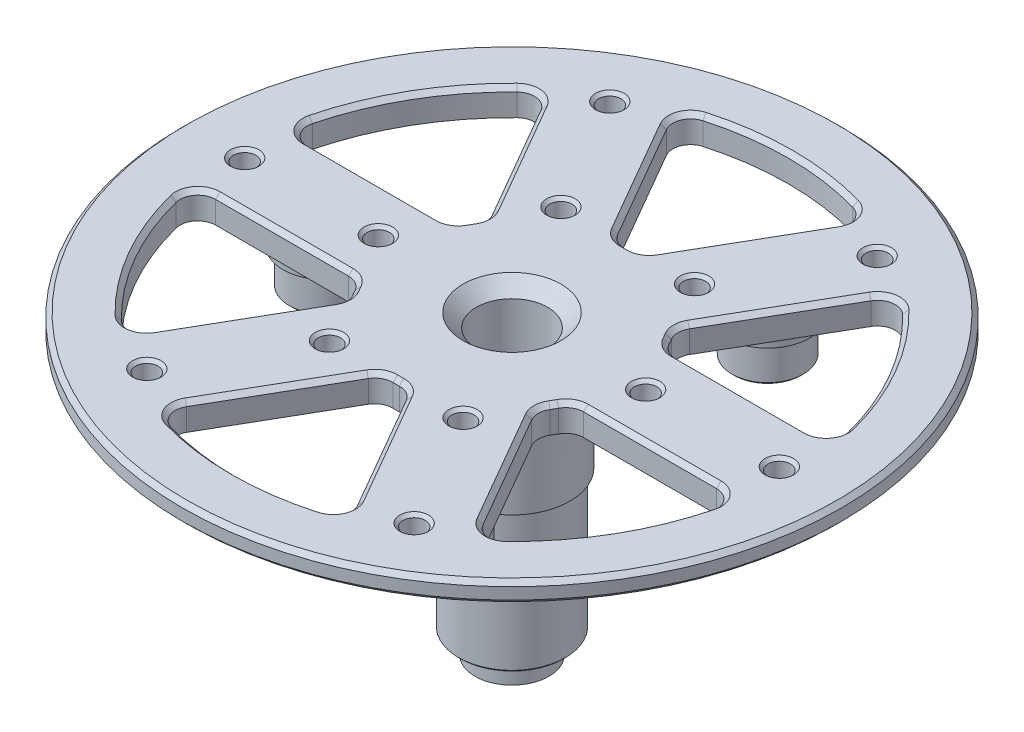
from build123d import *

# Parameters (mm, degrees)
CHAMFER1_SIZE                   = 0.5
CHAMFER2_SIZE                   = 0.25
CIRPATTERN1_COUNT               = 3
CHAMFER2_OF_CIRPATTERN1_SIZE    = 0.25
CHAMFER3_SIZE                   = 0.25
CHAMFER4_SIZE                   = 0.5
M3X0_5_TAPPED_HOLE1_D           = 2.5
M3X0_5_TAPPED_HOLE1_CSINK_D     = 3.2
M3X0_5_TAPPED_HOLE1_CSINK_ANGLE = 90
M3X0_5_TAPPED_HOLE2_D           = 2.5
M3X0_5_TAPPED_HOLE2_CSINK_D     = 3.2
M3X0_5_TAPPED_HOLE2_CSINK_ANGLE = 90
CIRPATTERN2_COUNT               = 6
CUT_EXTRUDE1_DEPTH              = 57.419943282
FILLET1_R                       = 2
CHAMFER5_SIZE                   = 0.5
CIRPATTERN3_COUNT               = 6
FILLET1_OF_CIRPATTERN3_R        = 2
CHAMFER5_OF_CIRPATTERN3_SIZE    = 0.5


with BuildPart() as part:
    # Sketch1 → Revolve1 (revolve)
    with BuildSketch(Plane.XY):
        Polygon((-3.15, -8.7), (-4, -8.7), (-4, 19.6), (-5.5, 21.1), (-37, 21.1), (-37, 18.8), (-32, 18.8), (-32, 18.1), (-6.5, 18.1), (-6.5, 6), (-6, 6), (-6, 5.15), (-6, -6), (-6, -7.1), (-6, -9.7), (-4.15, -9.7), (-4.15, -12.2), (-3.15, -12.2), align=None)
    revolve(axis=Axis((0, 0, 0), (0, -1, 0)))

    # Chamfer1
    chamfer1_edges = [part.edges().sort_by_distance(p)[0] for p in [
        (3.15, -12.2, 0),
    ]]
    chamfer(chamfer1_edges, length=CHAMFER1_SIZE)

    # Sketch2 → Planet bearing axis (revolve)
    with BuildSketch(Plane.XY):
        Polygon((-21, 18.1), (-25.7, 18.1), (-25.7, 17.1), (-25, 17.1), (-25, 13), (-21, 13), align=None)
    planet_bearing_axis = revolve(axis=Axis((-21, 33.164090746, 0), (0, -1, 0)))

    # Chamfer2
    chamfer2_edges = [part.edges().sort_by_distance(p)[0] for p in [
        (-17, 13, 0),
    ]]
    chamfer(chamfer2_edges, length=CHAMFER2_SIZE)

    # CirPattern1: Planet bearing axis ×3 about axis
    cirpattern1_axis = Axis((0, 0, 0), (0, 1, 0))
    for i in range(1, CIRPATTERN1_COUNT):
        add(planet_bearing_axis.rotate(cirpattern1_axis, i * 360 / CIRPATTERN1_COUNT))

    # Chamfer2 of CirPattern1
    chamfer2_of_cirpattern1_edges = [part.edges().sort_by_distance(p)[0] for p in [
        (8.5, 13, 14.722431864),
        (8.5, 13, -14.722431864),
    ]]
    chamfer(chamfer2_of_cirpattern1_edges, length=CHAMFER2_OF_CIRPATTERN1_SIZE)

    # Chamfer3
    chamfer3_edges = [part.edges().sort_by_distance(p)[0] for p in [
        (6, -9.7, 0),
    ]]
    chamfer(chamfer3_edges, length=CHAMFER3_SIZE)

    # Chamfer4
    chamfer4_edges = [part.edges().sort_by_distance(p)[0] for p in [
        (37, 21.1, 0),
        (37, 18.8, 0),
        (6.5, 18.1, 0),
    ]]
    chamfer(chamfer4_edges, length=CHAMFER4_SIZE)

    # M3x0.5 Tapped Hole1 (through all)
    with Locations(Plane(origin=(0, 21.1, 0), x_dir=(1, 0, 0), z_dir=(0, 1, 0))):
        with Locations((-30, 0)):
            m3x0_5_tapped_hole1 = CounterSinkHole(M3X0_5_TAPPED_HOLE1_D / 2, M3X0_5_TAPPED_HOLE1_CSINK_D / 2, counter_sink_angle=M3X0_5_TAPPED_HOLE1_CSINK_ANGLE)

    # M3x0.5 Tapped Hole2 (through all)
    with Locations(Plane(origin=(0, 21.1, 0), x_dir=(1, 0, 0), z_dir=(0, 1, 0))):
        with Locations((-15, 0)):
            m3x0_5_tapped_hole2 = CounterSinkHole(M3X0_5_TAPPED_HOLE2_D / 2, M3X0_5_TAPPED_HOLE2_CSINK_D / 2, counter_sink_angle=M3X0_5_TAPPED_HOLE2_CSINK_ANGLE)

    # CirPattern2: M3x0.5 Tapped Hole1, M3x0.5 Tapped Hole2 ×6 about axis
    cirpattern2_axis = Axis((0, 0, 0), (0, 1, 0))
    add([m3x0_5_tapped_hole1.rotate(cirpattern2_axis, i * 360 / CIRPATTERN2_COUNT) for i in range(1, CIRPATTERN2_COUNT)], mode=Mode.SUBTRACT)
    add([m3x0_5_tapped_hole2.rotate(cirpattern2_axis, i * 360 / CIRPATTERN2_COUNT) for i in range(1, CIRPATTERN2_COUNT)], mode=Mode.SUBTRACT)

    # Sketch7 → Cut-Extrude1 (cut, through all)
    with BuildSketch(Plane(origin=(0, 0, 0), x_dir=(1, 0, 0), z_dir=(0, 1, 0))):
        with BuildLine():
            Line((-19.745135369, -23.898318544), (-10.428637185, -7.76167034))
            ThreePointArc((-10.428637185, -7.76167034), (-11.258330249, -6.5), (-11.936122283, -5.150629559))
            Line((-11.936122283, -5.150629559), (-30.569118652, -5.150629559))
            ThreePointArc((-30.569118652, -5.150629559), (-26.846787517, -15.5), (-19.745135369, -23.898318544))
        make_face()
    cut_extrude1 = extrude(amount=CUT_EXTRUDE1_DEPTH, mode=Mode.SUBTRACT)

    # Fillet1
    fillet1_edges = [part.edges().sort_by_distance(p)[0] for p in [
        (-19.745135369, 19.6, 23.898318544),
        (-30.569118652, 19.6, 5.150629559),
        (-10.428637185, 19.6, 7.76167034),
        (-11.936122283, 19.6, 5.150629559),
    ]]
    fillet(fillet1_edges, radius=FILLET1_R)

    # Chamfer5
    chamfer5_edges = [part.edges().sort_by_distance(p)[0] for p in [
        (-14.783205948, 21.1, 15.304004683),
        (-10.785765167, 21.1, 7.817335996),
        (-19.971331194, 21.1, 22.745180132),
        (-11.258330249, 21.1, 6.5),
        (-26.846787517, 21.1, 15.5),
        (-12.162894146, 21.1, 5.432078636),
        (-29.683569404, 21.1, 5.923090095),
        (-20.645259809, 21.1, 5.150629559),
    ]]
    chamfer(chamfer5_edges, length=CHAMFER5_SIZE)

    # CirPattern3: Cut-Extrude1 ×6 about axis
    cirpattern3_axis = Axis((0, 0, 0), (0, 1, 0))
    for i in range(1, CIRPATTERN3_COUNT):
        add(cut_extrude1.rotate(cirpattern3_axis, i * 360 / CIRPATTERN3_COUNT), mode=Mode.SUBTRACT)

    # Fillet1 of CirPattern3
    fillet1_of_cirpattern3_edges = [part.edges().sort_by_distance(p)[0] for p in [
        (10.823983283, 19.6, 29.048948103),
        (-10.823983283, 19.6, 29.048948103),
        (1.507485098, 19.6, 12.912299899),
        (-1.507485098, 19.6, 12.912299899),
        (30.569118652, 19.6, 5.150629559),
        (19.745135369, 19.6, 23.898318544),
        (11.936122283, 19.6, 5.150629559),
        (10.428637185, 19.6, 7.76167034),
        (19.745135369, 19.6, -23.898318544),
        (30.569118652, 19.6, -5.150629559),
        (10.428637185, 19.6, -7.76167034),
        (11.936122283, 19.6, -5.150629559),
        (-10.823983283, 19.6, -29.048948103),
        (10.823983283, 19.6, -29.048948103),
        (-1.507485098, 19.6, -12.912299899),
        (1.507485098, 19.6, -12.912299899),
        (-30.569118652, 19.6, -5.150629559),
        (-19.745135369, 19.6, -23.898318544),
        (-11.936122283, 19.6, -5.150629559),
        (-10.428637185, 19.6, -7.76167034),
    ]]
    fillet(fillet1_of_cirpattern3_edges, radius=FILLET1_OF_CIRPATTERN3_R)

    # Chamfer5 of CirPattern3
    chamfer5_of_cirpattern3_edges = [part.edges().sort_by_distance(p)[0] for p in [
        (5.862053861, 21.1, 20.454634241),
        (1.377128979, 21.1, 13.249414632),
        (9.712238211, 21.1, 28.668270227),
        (0, 21.1, 13),
        (0, 21.1, 31),
        (-1.377128979, 21.1, 13.249414632),
        (-9.712238211, 21.1, 28.668270227),
        (-5.862053861, 21.1, 20.454634241),
        (20.645259809, 21.1, 5.150629559),
        (12.162894146, 21.1, 5.432078636),
        (29.683569404, 21.1, 5.923090095),
        (11.258330249, 21.1, 6.5),
        (26.846787517, 21.1, 15.5),
        (10.785765167, 21.1, 7.817335996),
        (19.971331194, 21.1, 22.745180132),
        (14.783205948, 21.1, 15.304004683),
        (14.783205948, 21.1, -15.304004683),
        (10.785765167, 21.1, -7.817335996),
        (19.971331194, 21.1, -22.745180132),
        (11.258330249, 21.1, -6.5),
        (26.846787517, 21.1, -15.5),
        (12.162894146, 21.1, -5.432078636),
        (29.683569404, 21.1, -5.923090095),
        (20.645259809, 21.1, -5.150629559),
        (-5.862053861, 21.1, -20.454634241),
        (-1.377128979, 21.1, -13.249414632),
        (-9.712238211, 21.1, -28.668270227),
        (0, 21.1, -13),
        (0, 21.1, -31),
        (1.377128979, 21.1, -13.249414632),
        (9.712238211, 21.1, -28.668270227),
        (5.862053861, 21.1, -20.454634241),
        (-20.645259809, 21.1, -5.150629559),
        (-12.162894146, 21.1, -5.432078636),
        (-29.683569404, 21.1, -5.923090095),
        (-11.258330249, 21.1, -6.5),
        (-26.846787517, 21.1, -15.5),
        (-10.785765167, 21.1, -7.817335996),
        (-19.971331194, 21.1, -22.745180132),
        (-14.783205948, 21.1, -15.304004683),
    ]]
    chamfer(chamfer5_of_cirpattern3_edges, length=CHAMFER5_OF_CIRPATTERN3_SIZE)


solid = part.part
